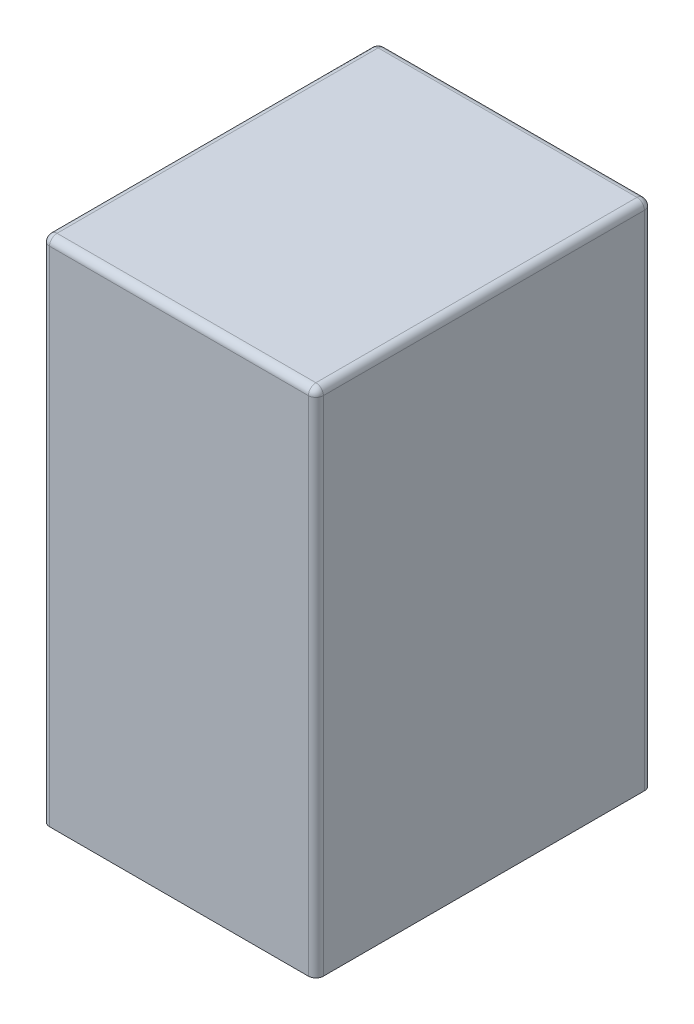
from build123d import *

# Parameters (mm, degrees)
SKETCH1_W           = 110
SKETCH1_H           = 135
SKETCH1_W_2         = 100
SKETCH1_H_2         = 125
BOSS_EXTRUDE1_DEPTH = 200
SKETCH2_W           = 110
SKETCH2_H           = 135
BOSS_EXTRUDE2_DEPTH = 5
CUT_EXTRUDE1_DEPTH  = 12
FILLET1_R           = 3


with BuildPart() as part:
    # Sketch1 → Boss-Extrude1 (new body)
    with BuildSketch(Plane(origin=(0, 0, 0), x_dir=(1, 0, 0), z_dir=(0, 1, 0))):
        Rectangle(SKETCH1_W, SKETCH1_H)
        Rectangle(SKETCH1_W_2, SKETCH1_H_2, mode=Mode.SUBTRACT)
    extrude(amount=BOSS_EXTRUDE1_DEPTH)

    # Sketch2 → Boss-Extrude2 (add)
    with BuildSketch(Plane(origin=(0, 200, 0), x_dir=(1, 0, 0), z_dir=(0, 1, 0))):
        Rectangle(SKETCH2_W, SKETCH2_H)
    extrude(amount=BOSS_EXTRUDE2_DEPTH)

    # Sketch3 → Cut-Extrude1 (cut)
    with BuildSketch(Plane.XZ):
        with BuildLine():
            ThreePointArc((1.45, -65), (0, -63.55), (-1.45, -65))
            Line((-1.45, -65), (1.45, -65))
        make_face()
        with BuildLine():
            Line((1.45, -65), (-1.45, -65))
            ThreePointArc((-1.45, -65), (0, -66.45), (1.45, -65))
        make_face()
        with BuildLine():
            ThreePointArc((53.95, -65), (53.525304833, -63.974695167), (52.5, -63.55))
            Line((52.5, -63.55), (52.5, -65))
            Line((52.5, -65), (51.05, -65))
            ThreePointArc((51.05, -65), (52.5, -66.45), (53.95, -65))
        make_face()
        with BuildLine():
            Line((52.5, -65), (52.5, -63.55))
            ThreePointArc((52.5, -63.55), (51.474695167, -63.974695167), (51.05, -65))
            Line((51.05, -65), (52.5, -65))
        make_face()
        with BuildLine():
            ThreePointArc((53.95, 0), (53.525304833, 1.025304833), (52.5, 1.45))
            Line((52.5, 1.45), (52.5, -1.45))
            ThreePointArc((52.5, -1.45), (53.525304833, -1.025304833), (53.95, 0))
        make_face()
        with BuildLine():
            Line((52.5, -1.45), (52.5, 1.45))
            ThreePointArc((52.5, 1.45), (51.05, 0), (52.5, -1.45))
        make_face()
        with BuildLine():
            ThreePointArc((53.95, 65), (52.5, 66.45), (51.05, 65))
            Line((51.05, 65), (52.5, 65))
            Line((52.5, 65), (52.5, 63.55))
            ThreePointArc((52.5, 63.55), (53.525304833, 63.974695167), (53.95, 65))
        make_face()
        with BuildLine():
            Line((52.5, 65), (51.05, 65))
            ThreePointArc((51.05, 65), (51.474695167, 63.974695167), (52.5, 63.55))
            Line((52.5, 63.55), (52.5, 65))
        make_face()
        with BuildLine():
            ThreePointArc((1.45, 65), (0, 66.45), (-1.45, 65))
            Line((-1.45, 65), (1.45, 65))
        make_face()
        with BuildLine():
            Line((1.45, 65), (-1.45, 65))
            ThreePointArc((-1.45, 65), (0, 63.55), (1.45, 65))
        make_face()
        with BuildLine():
            Line((-52.5, 63.55), (-52.5, 65))
            Line((-52.5, 65), (-51.05, 65))
            ThreePointArc((-51.05, 65), (-53.525304833, 66.025304833), (-52.5, 63.55))
        make_face()
        with BuildLine():
            Line((-51.05, 65), (-52.5, 65))
            Line((-52.5, 65), (-52.5, 63.55))
            ThreePointArc((-52.5, 63.55), (-51.474695167, 63.974695167), (-51.05, 65))
        make_face()
        with BuildLine():
            ThreePointArc((-51.05, 0), (-51.474695167, 1.025304833), (-52.5, 1.45))
            Line((-52.5, 1.45), (-52.5, -1.45))
            ThreePointArc((-52.5, -1.45), (-51.474695167, -1.025304833), (-51.05, 0))
        make_face()
        with BuildLine():
            Line((-52.5, -1.45), (-52.5, 1.45))
            ThreePointArc((-52.5, 1.45), (-53.95, 0), (-52.5, -1.45))
        make_face()
        with BuildLine():
            ThreePointArc((-51.05, -65), (-51.474695167, -63.974695167), (-52.5, -63.55))
            Line((-52.5, -63.55), (-52.5, -65))
            Line((-52.5, -65), (-51.05, -65))
        make_face()
        with BuildLine():
            Line((-52.5, -65), (-52.5, -63.55))
            ThreePointArc((-52.5, -63.55), (-53.525304833, -66.025304833), (-51.05, -65))
            Line((-51.05, -65), (-52.5, -65))
        make_face()
    extrude(amount=-CUT_EXTRUDE1_DEPTH, mode=Mode.SUBTRACT)

    # Fillet1
    fillet1_edges = [part.edges().sort_by_distance(p)[0] for p in [
        (0, 205, -67.5),
        (-55, 205, 0),
        (0, 205, 67.5),
        (55, 205, 0),
        (-55, 102.5, -67.5),
        (55, 102.5, -67.5),
        (55, 102.5, 67.5),
        (-55, 102.5, 67.5),
    ]]
    fillet(fillet1_edges, radius=FILLET1_R)


solid = part.part
